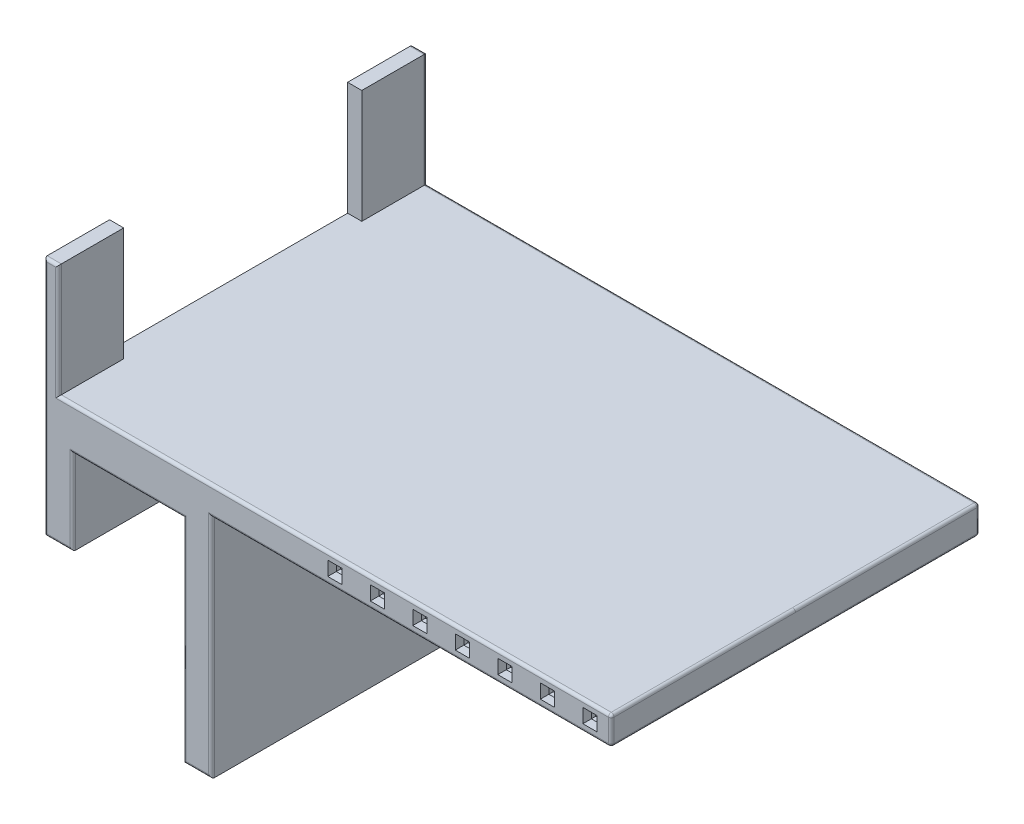
from build123d import *

# Parameters (mm, degrees)
EXTRUDE_1_DEPTH        = 65
SKETCH_5_W             = 5
SKETCH_5_H             = 5
CUT_EXTRUDE_1_DEPTH    = 3
SKETCH_7_W             = 5
SKETCH_7_H             = 23
EXTRUDE_2_DEPTH        = 40
FILLET_1_R             = 1
SKETCH_8_W             = 6
SKETCH_8_H             = 6
CUT_EXTRUDE_2_DEPTH    = 2
FILLET_1_OF_MIRROR_3_R = 1


with BuildPart() as part:
    # 草图1 → 凸台-拉伸1 (new body)
    with BuildSketch(Plane.XY):
        Polygon((190, 35), (190, 45), (-10, 45), (-10, 0), (0, 0), (0, 30), (39, 30), (39, -45), (49, -45), (49, 35), align=None)
    extrude_1 = extrude(amount=EXTRUDE_1_DEPTH)

    # 草图5 → 切除-拉伸1 (cut)
    with BuildSketch(Plane.XY.offset(65)):
        with Locations((167.5, 40)):
            Rectangle(SKETCH_5_W, SKETCH_5_H)
        with Locations((182.5, 40)):
            Rectangle(SKETCH_5_W, SKETCH_5_H)
        with Locations((152.5, 40)):
            Rectangle(SKETCH_5_W, SKETCH_5_H)
        with Locations((137.5, 40)):
            Rectangle(SKETCH_5_W, SKETCH_5_H)
        with Locations((122.5, 40)):
            Rectangle(SKETCH_5_W, SKETCH_5_H)
        with Locations((107.5, 40)):
            Rectangle(SKETCH_5_W, SKETCH_5_H)
        with Locations((92.5, 40)):
            Rectangle(SKETCH_5_W, SKETCH_5_H)
    cut_extrude_1 = extrude(amount=-CUT_EXTRUDE_1_DEPTH, mode=Mode.SUBTRACT)

    # 草图7 → 凸台-拉伸2 (add)
    with BuildSketch(Plane(origin=(0, 45, 0), x_dir=(1, 0, 0), z_dir=(0, 1, 0))):
        with Locations((-7.5, -53.5)):
            Rectangle(SKETCH_7_W, SKETCH_7_H)
    extrude_2 = extrude(amount=EXTRUDE_2_DEPTH)

    # 圆角1
    fillet_1_edges = [part.edges().sort_by_distance(p)[0] for p in [
        (-5, 65, 65),
        (-7.5, 85, 65),
        (-5, 0, 65),
        (0, 15, 65),
        (190, 45, 32.5),
        (190, 35, 32.5),
        (19.5, 30, 65),
        (39, -7.5, 65),
        (44, -45, 65),
        (49, -5, 65),
        (119.5, 35, 65),
        (190, 40, 65),
        (92.5, 45, 65),
        (-10, 42.5, 65),
    ]]
    fillet(fillet_1_edges, radius=FILLET_1_R)

    # 草图8 → 切除-拉伸2 (cut)
    with BuildSketch(Plane.XY.offset(62)):
        with Locations((182.5, 40)):
            Rectangle(SKETCH_8_W, SKETCH_8_H)
        with Locations((167.5, 40)):
            Rectangle(SKETCH_8_W, SKETCH_8_H)
        with Locations((152.5, 40)):
            Rectangle(SKETCH_8_W, SKETCH_8_H)
        with Locations((137.5, 40)):
            Rectangle(SKETCH_8_W, SKETCH_8_H)
        with Locations((122.5, 40)):
            Rectangle(SKETCH_8_W, SKETCH_8_H)
        with Locations((107.5, 40)):
            Rectangle(SKETCH_8_W, SKETCH_8_H)
        with Locations((92.5, 40)):
            Rectangle(SKETCH_8_W, SKETCH_8_H)
    extrude(amount=-CUT_EXTRUDE_2_DEPTH, mode=Mode.SUBTRACT)

    # 镜向3: 凸台-拉伸1, 切除-拉伸1, 凸台-拉伸2 across plane
    add(extrude_1.mirror(Plane.XY))
    add(cut_extrude_1.mirror(Plane.XY), mode=Mode.SUBTRACT)
    add(extrude_2.mirror(Plane.XY))

    # 圆角1 of 镜向3
    fillet_1_of_mirror_3_edges = [part.edges().sort_by_distance(p)[0] for p in [
        (-5, 65, -65),
        (-7.5, 85, -65),
        (-5, 0, -65),
        (0, 15, -65),
        (190, 45, -32.5),
        (190, 35, -32.5),
        (19.5, 30, -65),
        (39, -7.5, -65),
        (44, -45, -65),
        (49, -5, -65),
        (119.5, 35, -65),
        (190, 40, -65),
        (92.5, 45, -65),
        (-10, 42.5, -65),
    ]]
    fillet(fillet_1_of_mirror_3_edges, radius=FILLET_1_OF_MIRROR_3_R)


solid = part.part
